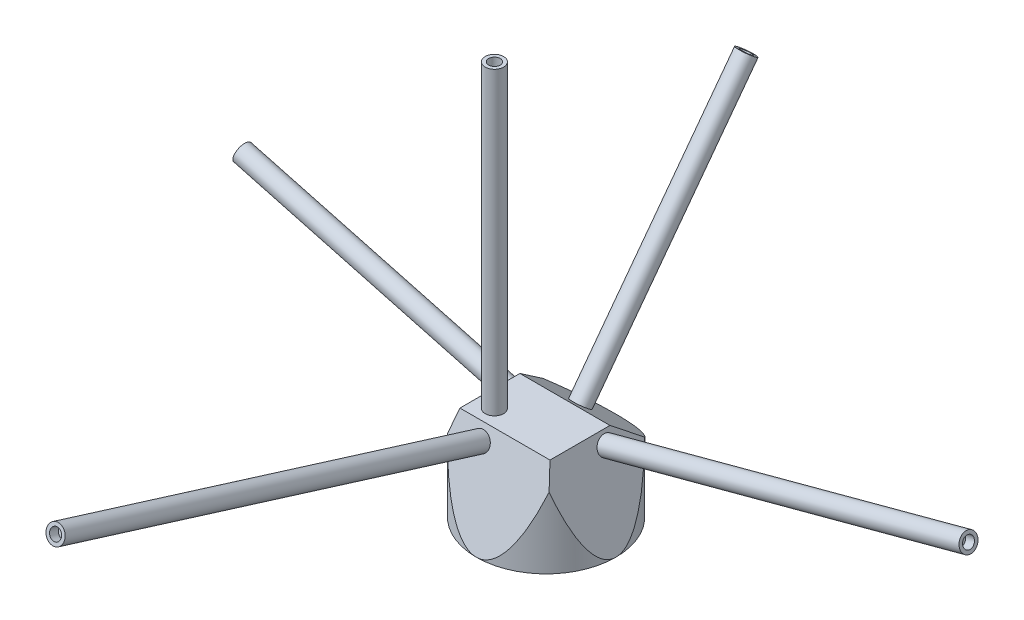
from build123d import *

# Parameters (mm, degrees)
SKETCH1_R           = 15.115
BOSS_EXTRUDE1_DEPTH = 20
CUT_EXTRUDE1_DEPTH  = 40.272332818
CUT_EXTRUDE3_DEPTH  = 40.272332818
SKETCH8_R           = 1.99
BOSS_EXTRUDE2_DEPTH = 65
SKETCH9_R           = 1.25
CUT_EXTRUDE4_DEPTH  = 2
SKETCH11_R          = 1.99
BOSS_EXTRUDE3_DEPTH = 96.4
SKETCH12_R          = 1.25
CUT_EXTRUDE5_DEPTH  = 2
SKETCH13_R          = 1.99
BOSS_EXTRUDE4_DEPTH = 81.15
SKETCH14_R          = 1.25
CUT_EXTRUDE6_DEPTH  = 2
SKETCH15_R          = 1.99
BOSS_EXTRUDE5_DEPTH = 60
SKETCH16_R          = 1.25
CUT_EXTRUDE7_DEPTH  = 2
SKETCH17_R          = 1.99
BOSS_EXTRUDE6_DEPTH = 60
SKETCH18_R          = 1.25
CUT_EXTRUDE8_DEPTH  = 2


with BuildPart() as part:
    # Sketch1 → Boss-Extrude1 (new body)
    with BuildSketch(Plane(origin=(0, 0, 0), x_dir=(1, 0, 0), z_dir=(0, 1, 0))):
        with Locations(Location((0, 0, 0), (0, 0, 270))):
            Circle(SKETCH1_R)
    extrude(amount=-BOSS_EXTRUDE1_DEPTH)

    # Sketch3 → Cut-Extrude1 (cut, through all)
    with BuildSketch(Plane(origin=(15.115, 0, 0), x_dir=(0, 0, -1), z_dir=(1, 0, 0))):
        Polygon((-8.905426603, 0), (-15.115, -20), (-15.115, 0), align=None)
        Polygon((4.07457383, 0), (15.115, -8.259757639), (15.115, 0), align=None)
    extrude(amount=-CUT_EXTRUDE1_DEPTH, mode=Mode.SUBTRACT)

    # Sketch7 → Cut-Extrude3 (cut, through all)
    with BuildSketch(Plane.XY.offset(15.115)):
        Polygon((15.115, 0), (9.75, 0), (15.115, -20), align=None)
        Polygon((-15.115, -20), (-15.115, 0), (-9.75, 0), align=None)
    extrude(amount=-CUT_EXTRUDE3_DEPTH, mode=Mode.SUBTRACT)

    # Sketch8 → Boss-Extrude2 (add)
    with BuildSketch(Plane(origin=(0, 0, 0), x_dir=(1, 0, 0), z_dir=(0, 1, 0))):
        with Locations(Location((-5.953992214, -5.238739903, 0), (0, 0, 270))):
            Circle(SKETCH8_R)
    extrude(amount=BOSS_EXTRUDE2_DEPTH)

    # Sketch9 → Cut-Extrude4 (cut)
    with BuildSketch(Plane(origin=(0, 65, 0), x_dir=(1, 0, 0), z_dir=(0, 1, 0))):
        with Locations(Location((-5.953992214, -5.238739903, 0), (0, 0, 270))):
            Circle(SKETCH9_R)
    extrude(amount=-CUT_EXTRUDE4_DEPTH, mode=Mode.SUBTRACT)

    # Sketch11 → Boss-Extrude3 (add)
    with BuildSketch(Plane(origin=(0, 2.521846553, 8.12244704), x_dir=(1, 0, 0), z_dir=(0, 0.296515806173068, 0.9550279455018769))):
        with Locations(Location((-4.312884214, -5.801881574, 0), (0, 0, 90))):
            Circle(SKETCH11_R)
    extrude(amount=BOSS_EXTRUDE3_DEPTH)

    # Sketch12 → Cut-Extrude5 (cut)
    with BuildSketch(Plane(origin=(0, 31.105970268, 100.187140986), x_dir=(1, 0, 0), z_dir=(0, 0.2965158061730681, 0.9550279455018768))):
        with Locations(Location((-4.312884214, -5.801881574, 0), (0, 0, 270))):
            Circle(SKETCH12_R)
    extrude(amount=-CUT_EXTRUDE5_DEPTH, mode=Mode.SUBTRACT)

    # Sketch13 → Boss-Extrude4 (add)
    with BuildSketch(Plane(origin=(9.095505077, 2.439869237, 0), x_dir=(0, 0, -1), z_dir=(0.9658531542677156, 0.25909010863231474, 0))):
        with Locations(Location((2.631146058, -5.274029077, 0), (0, 0, 270))):
            Circle(SKETCH13_R)
    extrude(amount=BOSS_EXTRUDE4_DEPTH)

    # Sketch14 → Cut-Extrude6 (cut)
    with BuildSketch(Plane(origin=(87.474488546, 23.465031552, 0), x_dir=(0, 0, -1), z_dir=(0.9658531542677156, 0.2590901086323148, 0))):
        with Locations(Location((2.631146058, -5.274029077, 0), (0, 0, 90))):
            Circle(SKETCH14_R)
    extrude(amount=-CUT_EXTRUDE6_DEPTH, mode=Mode.SUBTRACT)

    # Sketch15 → Boss-Extrude5 (add)
    with BuildSketch(Plane(origin=(-9.095505077, 2.439869237, 0), x_dir=(0, 0, 1), z_dir=(-0.9658531542677156, 0.25909010863231474, 0))):
        with Locations(Location((-2.63114606, -5.274029079, 0), (0, 0, 90))):
            Circle(SKETCH15_R)
    extrude(amount=BOSS_EXTRUDE5_DEPTH)

    # Sketch16 → Cut-Extrude7 (cut)
    with BuildSketch(Plane(origin=(-67.046694333, 17.985275755, 0), x_dir=(0, 0, 1), z_dir=(-0.9658531542677156, 0.2590901086323148, 0))):
        with Locations(Location((-2.63114606, -5.274029079, 0), (0, 0, 270))):
            Circle(SKETCH16_R)
    extrude(amount=-CUT_EXTRUDE7_DEPTH, mode=Mode.SUBTRACT)

    # Sketch17 → Boss-Extrude6 (add)
    with BuildSketch(Plane(origin=(0, 1.95442878, -1.462181603), x_dir=(1, 0, 0), z_dir=(0, 0.8007152420957264, -0.5990451577932857))):
        with Locations(Location((0, 7.441155509, 0), (0, 0, 90))):
            Circle(SKETCH17_R)
    extrude(amount=BOSS_EXTRUDE6_DEPTH)

    # Sketch18 → Cut-Extrude8 (cut)
    with BuildSketch(Plane(origin=(0, 49.997343305, -37.404891071), x_dir=(1, 0, 0), z_dir=(0, 0.8007152420957262, -0.5990451577932858))):
        with Locations(Location((0, 7.441155509, 0), (0, 0, 270))):
            Circle(SKETCH18_R)
    extrude(amount=-CUT_EXTRUDE8_DEPTH, mode=Mode.SUBTRACT)


solid = part.part
